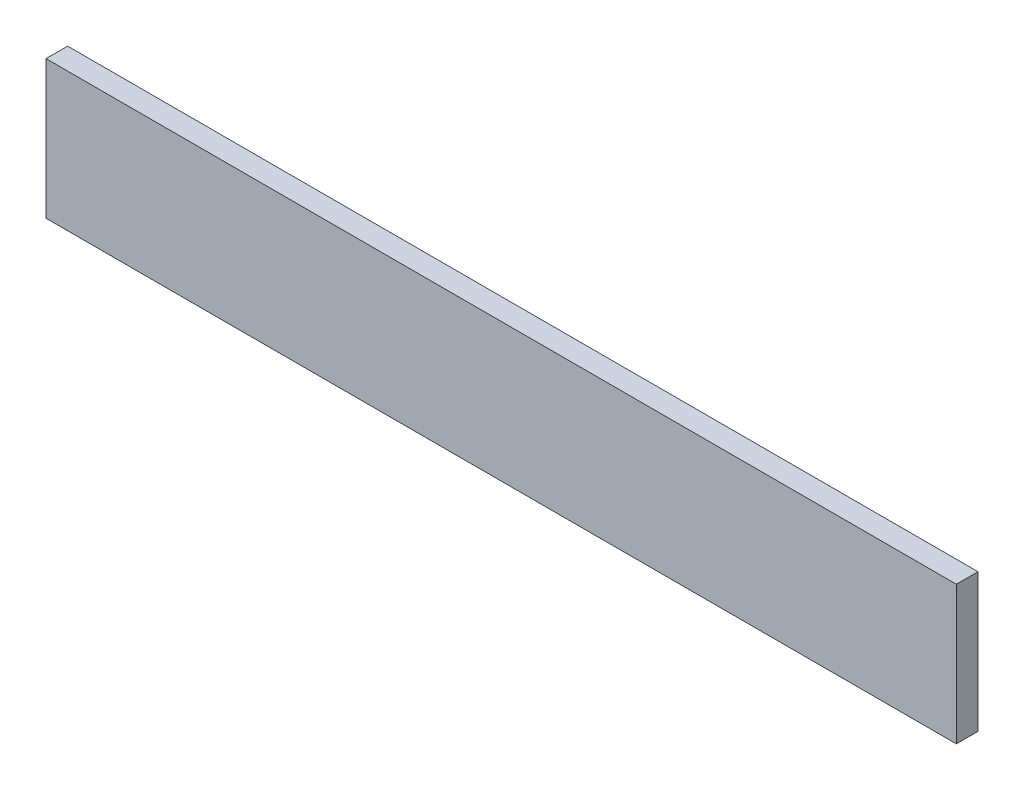
from build123d import *

# Parameters (mm, degrees)
CROQUIS1_W              = 757.15
CROQUIS1_H              = 115
SALIENTE_EXTRUIR1_DEPTH = 18


with BuildPart() as part:
    # Croquis1 → Saliente-Extruir1 (new body)
    with BuildSketch(Plane.XY):
        Rectangle(CROQUIS1_W, CROQUIS1_H)
    extrude(amount=SALIENTE_EXTRUIR1_DEPTH)


solid = part.part
